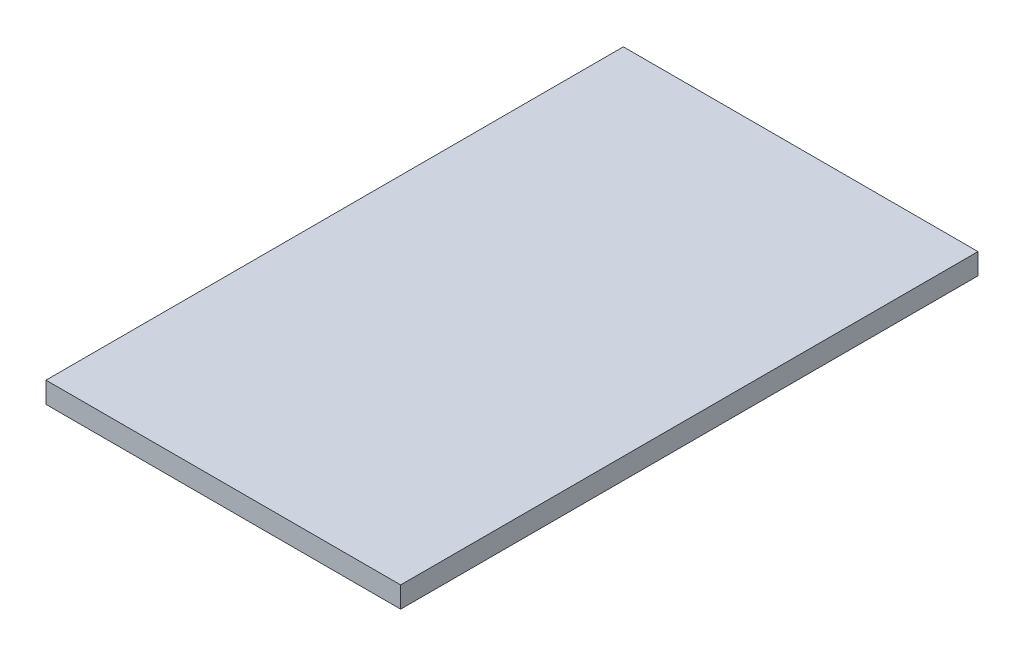
from build123d import *

# Parameters (mm, degrees)
SKETCH_1_W      = 43
SKETCH_1_H      = 70
EXTRUDE_1_DEPTH = 2.55
SKETCH_2_W      = 20.32
SKETCH_2_H      = 2.54
EXTRUDE_2_DEPTH = 2.5


with BuildPart() as part:
    # 草图1 → 凸台-拉伸1 (new body)
    with BuildSketch(Plane(origin=(0, 0, 0), x_dir=(1, 0, 0), z_dir=(0, 1, 0))):
        Rectangle(SKETCH_1_W, SKETCH_1_H)
    extrude(amount=EXTRUDE_1_DEPTH)

    # 草图2 → 凸台-拉伸2 (add)
    with BuildSketch(Plane(origin=(0, 0, 0), x_dir=(-1, 0, 0), z_dir=(0, -1, 0))):
        with Locations((0, 33.73)):
            Rectangle(SKETCH_2_W, SKETCH_2_H)
    extrude(amount=EXTRUDE_2_DEPTH)


solid = part.part
